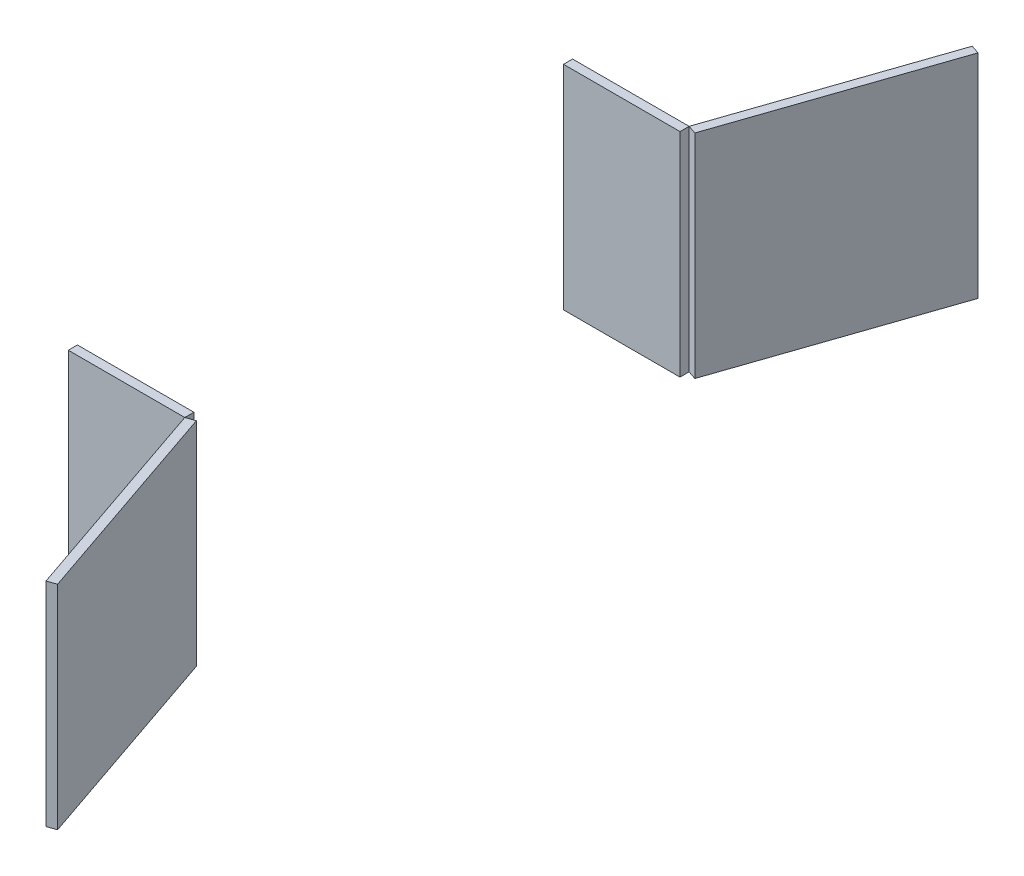
from build123d import *

# Parameters (mm, degrees)
CROQUIS1_W                = 38.357380244
CROQUIS1_H                = 3
SALIENTE_EXTRUIR1_DEPTH   = 70
SALIENTE_EXTRUIR1_2_DEPTH = 70
SALIENTE_EXTRUIR1_3_DEPTH = 70
SALIENTE_EXTRUIR1_4_DEPTH = 70


with BuildPart() as part:
    # Croquis1 → Saliente-Extruir1 (new body)
    with BuildSketch(Plane(origin=(0, 0, 0), x_dir=(1, 0, 0), z_dir=(0, 1, 0))):
        with Locations((-19.178690122, -81.5)):
            Rectangle(CROQUIS1_W, CROQUIS1_H)
    extrude(amount=SALIENTE_EXTRUIR1_DEPTH)


with BuildPart() as body_2:
    # Croquis1 → Saliente-Extruir1 2 (new body)
    with BuildSketch(Plane(origin=(0, 0, 0), x_dir=(1, 0, 0), z_dir=(0, 1, 0))):
        Polygon((26.602686749, -151.478752289), (23.764257979, -152.45), (0, -83), (2.83842877, -82.028752289), align=None)
    extrude(amount=SALIENTE_EXTRUIR1_2_DEPTH)


with BuildPart() as body_3:
    # Croquis1 → Saliente-Extruir1 3 (new body)
    with BuildSketch(Plane(origin=(0, 0, 0), x_dir=(1, 0, 0), z_dir=(0, 1, 0))):
        with Locations((-19.178690122, 81.5)):
            Rectangle(CROQUIS1_W, CROQUIS1_H)
    extrude(amount=SALIENTE_EXTRUIR1_3_DEPTH)


with BuildPart() as body_4:
    # Croquis1 → Saliente-Extruir1 4 (new body)
    with BuildSketch(Plane(origin=(0, 0, 0), x_dir=(1, 0, 0), z_dir=(0, 1, 0))):
        Polygon((26.602686749, 151.478752289), (2.83842877, 82.028752289), (0, 83), (23.764257979, 152.45), align=None)
    extrude(amount=SALIENTE_EXTRUIR1_4_DEPTH)


solid = Compound([part.part, body_2.part, body_3.part, body_4.part])
